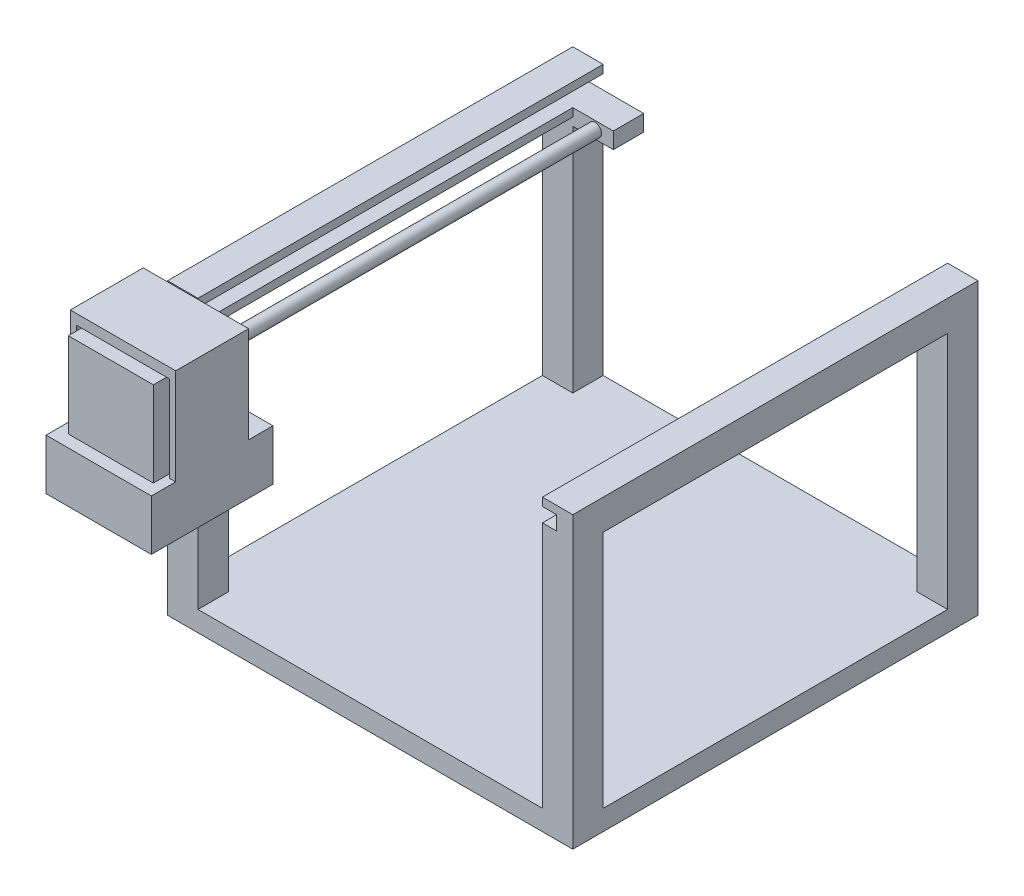
from build123d import *

# Parameters (mm, degrees)
SKETCH_1_W          = 200
SKETCH_1_H          = 10
EXTRUDE_1_DEPTH     = 200
SKETCH_2_W          = 15
SKETCH_2_H          = 15
EXTRUDE_2_DEPTH     = 133
EXTRUDE_3_REACH     = 309.691
SKETCH_6_W          = 15
SKETCH_6_H          = 15
CUT_EXTRUDE_1_REACH = 318.937
SKETCH_7_W          = 7
SKETCH_7_H          = 7
SKETCH_8_W          = 52
SKETCH_8_H          = 25
EXTRUDE_4_DEPTH     = 60
SKETCH_9_W          = 3
SKETCH_9_H          = 36
EXTRUDE_7_DEPTH     = 47.5
SKETCH_12_W         = 42
SKETCH_12_H         = 42
EXTRUDE_8_DEPTH     = 42
EXTRUDE_9_REACH     = 296.4
SKETCH_14_W         = 36
SKETCH_14_H         = 5
SKETCH_15_W         = 20
SKETCH_15_H         = 8
EXTRUDE_10_DEPTH    = 15
EXTRUDE_11_REACH    = 331.87
SKETCH_13_R         = 3.175


with BuildPart() as part:
    # 草图1 → 凸台-拉伸1 (new body)
    with BuildSketch(Plane.XY):
        with Locations((100, 5)):
            Rectangle(SKETCH_1_W, SKETCH_1_H)
    extrude(amount=-EXTRUDE_1_DEPTH)

    # 草图2 → 凸台-拉伸2 (add)
    with BuildSketch(Plane(origin=(0, 10, 0), x_dir=(1, 0, 0), z_dir=(0, 1, 0))):
        with Locations((7.5, 7.5)):
            Rectangle(SKETCH_2_W, SKETCH_2_H)
        with Locations((192.5, 7.5)):
            Rectangle(SKETCH_2_W, SKETCH_2_H)
        with Locations((192.5, 192.5)):
            Rectangle(SKETCH_2_W, SKETCH_2_H)
        with Locations((7.5, 192.5)):
            Rectangle(SKETCH_2_W, SKETCH_2_H)
    extrude(amount=EXTRUDE_2_DEPTH)

    # 草图6 → 凸台-拉伸3 (add, up to next)
    with BuildSketch(Plane.XY.offset(-185), mode=Mode.PRIVATE) as extrude_3_sk1:
        with Locations((7.5, 135.5)):
            Rectangle(SKETCH_6_W, SKETCH_6_H)
    extrude_3_tool1 = extrude(extrude_3_sk1.sketch, amount=EXTRUDE_3_REACH, mode=Mode.PRIVATE) - part.part
    # 草图6 → 凸台-拉伸3 (add, up to next)
    with BuildSketch(Plane.XY.offset(-185), mode=Mode.PRIVATE) as extrude_3_sk2:
        with Locations((192.5, 135.5)):
            Rectangle(SKETCH_6_W, SKETCH_6_H)
    extrude_3_tool2 = extrude(extrude_3_sk2.sketch, amount=EXTRUDE_3_REACH, mode=Mode.PRIVATE) - part.part
    add(extrude_3_tool1.solids().sort_by_distance((7.5, 135.5, -185))[0])
    add(extrude_3_tool2.solids().sort_by_distance((192.5, 135.5, -185))[0])

    # 草图7 → 切除-拉伸1 (cut, up to next)
    with BuildSketch(Plane.XY, mode=Mode.PRIVATE) as cut_extrude_1_sk1:
        with Locations((11.5, 135.5)):
            Rectangle(SKETCH_7_W, SKETCH_7_H)
    cut_extrude_1_tool1 = extrude(cut_extrude_1_sk1.sketch, amount=-CUT_EXTRUDE_1_REACH, mode=Mode.PRIVATE) & part.part
    # 草图7 → 切除-拉伸1 (cut, up to next)
    with BuildSketch(Plane.XY, mode=Mode.PRIVATE) as cut_extrude_1_sk2:
        with Locations((188.5, 135.5)):
            Rectangle(SKETCH_7_W, SKETCH_7_H)
    cut_extrude_1_tool2 = extrude(cut_extrude_1_sk2.sketch, amount=-CUT_EXTRUDE_1_REACH, mode=Mode.PRIVATE) & part.part
    add(cut_extrude_1_tool1.solids().sort_by_distance((11.5, 135.5, 0))[0], mode=Mode.SUBTRACT)
    add(cut_extrude_1_tool2.solids().sort_by_distance((188.5, 135.5, 0))[0], mode=Mode.SUBTRACT)

    # 草图8 → 凸台-拉伸4 (add)
    with BuildSketch(Plane.XY):
        with Locations((26, 94.5)):
            Rectangle(SKETCH_8_W, SKETCH_8_H)
    extrude(amount=EXTRUDE_4_DEPTH)

    # 草图9 → 凸台-拉伸7 (add)
    with BuildSketch(Plane(origin=(0, 107, 0), x_dir=(1, 0, 0), z_dir=(0, 1, 0))):
        with Locations((50.5, -30)):
            Rectangle(SKETCH_9_W, SKETCH_9_H)
        with Locations((1.5, -30)):
            Rectangle(SKETCH_9_W, SKETCH_9_H)
    extrude(amount=EXTRUDE_7_DEPTH)

    # 草图12 → 凸台-拉伸8 (add)
    with BuildSketch(Plane(origin=(0, 107, 0), x_dir=(1, 0, 0), z_dir=(0, 1, 0))):
        with Locations((26, -33)):
            Rectangle(SKETCH_12_W, SKETCH_12_H)
    extrude(amount=EXTRUDE_8_DEPTH)

    # 草图14 → 凸台-拉伸9 (add, up to next)
    with BuildSketch(Plane.ZY.offset(-49), mode=Mode.PRIVATE) as extrude_9_sk1:
        with Locations((30, 152)):
            Rectangle(SKETCH_14_W, SKETCH_14_H)
    extrude_9_tool1 = extrude(extrude_9_sk1.sketch, amount=EXTRUDE_9_REACH, mode=Mode.PRIVATE) - part.part
    add(extrude_9_tool1.solids().sort_by_distance((49, 152, 30))[0])

    # 草图15 → 凸台-拉伸10 (add)
    with BuildSketch(Plane(origin=(0, 0, -200), x_dir=(-1, 0, 0), z_dir=(0, 0, -1))):
        with Locations((-25, 128)):
            Rectangle(SKETCH_15_W, SKETCH_15_H)
    extrude(amount=-EXTRUDE_10_DEPTH)

    # 草图13 → 凸台-拉伸11 (add, up to next)
    with BuildSketch(Plane(origin=(0, 0, 12), x_dir=(-1, 0, 0), z_dir=(0, 0, -1)), mode=Mode.PRIVATE) as extrude_11_sk1:
        with Locations((-26, 128)):
            Circle(SKETCH_13_R)
    extrude_11_tool1 = extrude(extrude_11_sk1.sketch, amount=EXTRUDE_11_REACH, mode=Mode.PRIVATE) - part.part
    add(extrude_11_tool1.solids().sort_by_distance((26, 128, 12))[0])


solid = part.part
